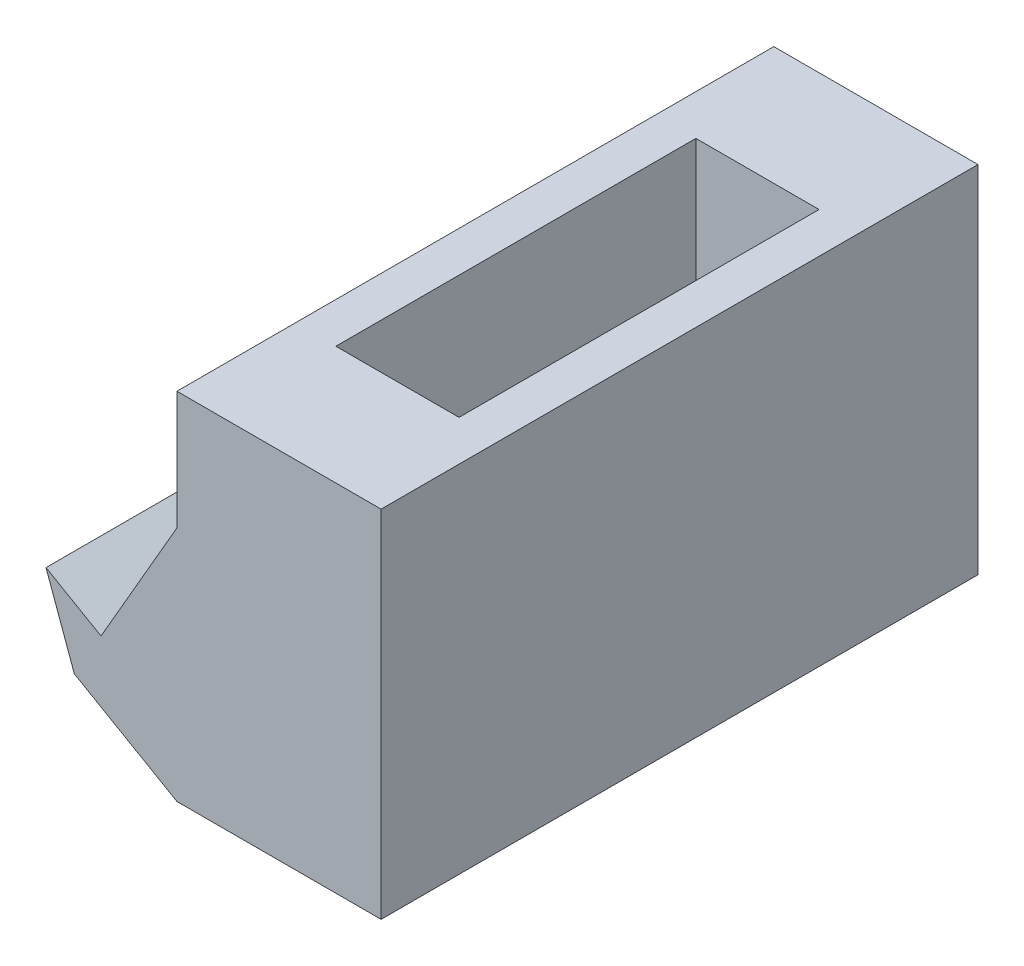
from build123d import *

# Parameters (mm, degrees)
EXTRUDE_1_DEPTH      = 5
EXTRUDE_1_DEPTH_BACK = 10
SKETCH_1_W           = 8.621052632
SKETCH_1_H           = 25.2
SKETCH_1_W_2         = 5.2
SKETCH_1_H_2         = 15.2
EXTRUDE_3_DEPTH      = 25.2


with BuildPart() as part:
    # 草图1 → 凸台-拉伸1 (new, two sides: drawn at the far end of the back side and taken through both)
    with BuildSketch(Plane(origin=(0, 0, 0), x_dir=(1, 0, 0), z_dir=(0, 1, 0)).offset(-EXTRUDE_1_DEPTH_BACK)):
        Rectangle(SKETCH_1_W, SKETCH_1_H)
        Rectangle(SKETCH_1_W_2, SKETCH_1_H_2, mode=Mode.SUBTRACT)
    extrude(amount=EXTRUDE_1_DEPTH + EXTRUDE_1_DEPTH_BACK)

    # 草图2 → 凸台-拉伸3 (add)
    with BuildSketch(Plane.XY.offset(12.6)):
        Polygon((-4.310526316, 0), (-4.310526316, -10), (-8.640653335, -7.5), (-9.837723836, -4.211075827), (-7.515775018, -5.551653603), align=None)
    extrude(amount=-EXTRUDE_3_DEPTH)


solid = part.part
